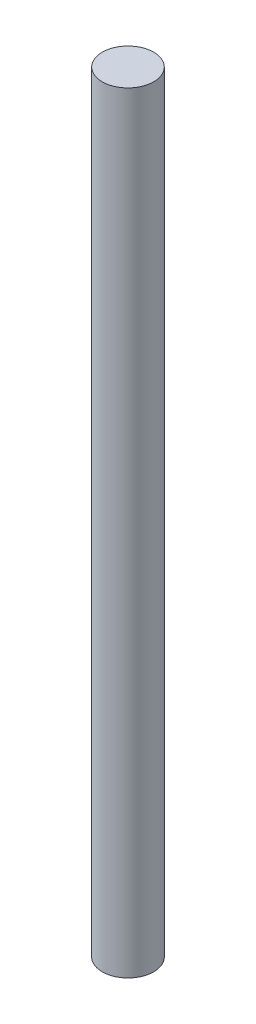
from build123d import *

# Parameters (mm, degrees)
SKETCH_1_R      = 5
EXTRUDE_2_DEPTH = 150


with BuildPart() as part:
    # 草图1 → 凸台-拉伸2 (new body)
    with BuildSketch(Plane(origin=(0, 0, 0), x_dir=(1, 0, 0), z_dir=(0, 1, 0))):
        with Locations(Location((0, 0, 0), (0, 0, 270))):
            Circle(SKETCH_1_R)
    extrude(amount=EXTRUDE_2_DEPTH)


solid = part.part
